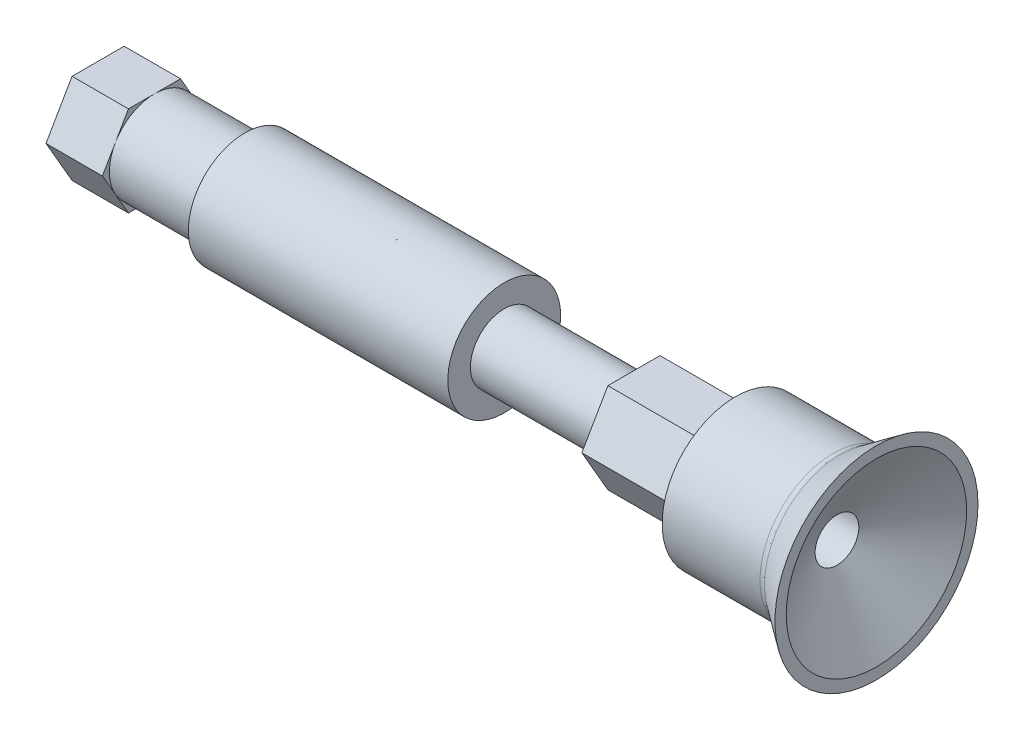
from build123d import *

# Parameters (mm, degrees)
EXTRUDE_1_DEPTH     = 5
SKETCH_2_R          = 4
EXTRUDE_2_DEPTH     = 8
SKETCH_3_R          = 5
EXTRUDE_3_DEPTH     = 23
SKETCH_4_R          = 3
EXTRUDE_4_DEPTH     = 11.5
EXTRUDE_5_DEPTH     = 9
SKETCH_6_R          = 2.5
CUT_EXTRUDE_1_DEPTH = 5
SKETCH_7_R          = 2
CUT_EXTRUDE_2_DEPTH = 8
SKETCH_8_R          = 2.5
CUT_EXTRUDE_3_DEPTH = 45.070965499
SKETCH_9_R          = 6.5
EXTRUDE_6_DEPTH     = 9
FILLET_1_R          = 1
SKETCH_11_R         = 8
CUT_EXTRUDE_4_DEPTH = 3.5
CUT_EXTRUDE_4_DRAFT = -60
CUT_EXTRUDE_START   = -10
SKETCH_12_R         = 2.5
CUT_EXTRUDE_5_DEPTH = 10


with BuildPart() as part:
    # 草图1 → 凸台-拉伸1 (new body)
    with BuildSketch(Plane(origin=(0, 0, 0), x_dir=(0, 0, -1), z_dir=(1, 0, 0))):
        Polygon((2.309401077, 4), (-2.309401077, 4), (-4.618802154, 0), (-2.309401077, -4), (2.309401077, -4), (4.618802154, 0), align=None)
    extrude(amount=EXTRUDE_1_DEPTH)

    # 草图2 → 凸台-拉伸2 (add)
    with BuildSketch(Plane(origin=(5, 0, 0), x_dir=(0, 0, -1), z_dir=(1, 0, 0))):
        with Locations(Location((0, 0, 0), (0, 0, 150))):
            Circle(SKETCH_2_R)
    extrude(amount=EXTRUDE_2_DEPTH)

    # 草图3 → 凸台-拉伸3 (add)
    with BuildSketch(Plane(origin=(13, 0, 0), x_dir=(0, 0, -1), z_dir=(1, 0, 0))):
        Circle(SKETCH_3_R)
    extrude(amount=EXTRUDE_3_DEPTH)

    # 草图4 → 凸台-拉伸4 (add)
    with BuildSketch(Plane(origin=(36, 0, 0), x_dir=(0, 0, -1), z_dir=(1, 0, 0))):
        Circle(SKETCH_4_R)
    extrude(amount=EXTRUDE_4_DEPTH)

    # 草图5 → 凸台-拉伸5 (add)
    with BuildSketch(Plane(origin=(47.5, 0, 0), x_dir=(0, 0, -1), z_dir=(1, 0, 0))):
        Polygon((2.309401077, 4), (-2.309401077, 4), (-4.618802154, 0), (-2.309401077, -4), (2.309401077, -4), (4.618802154, 0), align=None)
    extrude(amount=EXTRUDE_5_DEPTH)

    # 草图6 → 切除-拉伸1 (cut)
    with BuildSketch(Plane.ZY):
        Circle(SKETCH_6_R)
    extrude(amount=-CUT_EXTRUDE_1_DEPTH, mode=Mode.SUBTRACT)

    # 草图7 → 切除-拉伸2 (cut)
    with BuildSketch(Plane.ZY.offset(-5)):
        Circle(SKETCH_7_R)
    extrude(amount=-CUT_EXTRUDE_2_DEPTH, mode=Mode.SUBTRACT)

    # 草图8 → 切除-拉伸3 (cut, through all)
    with BuildSketch(Plane.ZY.offset(-13)):
        Circle(SKETCH_8_R)
    extrude(amount=-CUT_EXTRUDE_3_DEPTH, mode=Mode.SUBTRACT)

    # 草图9 → 凸台-拉伸6 (add)
    with BuildSketch(Plane(origin=(56.5, 0, 0), x_dir=(0, 0, -1), z_dir=(1, 0, 0))):
        Circle(SKETCH_9_R)
    extrude(amount=EXTRUDE_6_DEPTH)

    # 草图10 → 旋转1 (revolve)
    with BuildSketch(Plane(origin=(0, 0, 0), x_dir=(-1, 0, 0), z_dir=(0, 0, -1)), mode=Mode.PRIVATE) as revolve_1_sk:
        Polygon((-65.5, 0), (-69, 0), (-69, 9), (-65.5, 6.5), align=None)
    revolve(revolve_1_sk.sketch.rotate(Axis((65.5, 0, 0), (-1, 0, 0)), 90), axis=Axis((65.5, 0, 0), (-1, 0, 0)))

    # 圆角1
    fillet_1_edges = [part.edges().sort_by_distance(p)[0] for p in [
        (65.5, 0, 6.5),
    ]]
    fillet(fillet_1_edges, radius=FILLET_1_R)


with BuildPart() as cut_extrude_4_tool:
    # 草图11 → 切除-拉伸4 (with draft: the straight prism first)
    with BuildSketch(Plane(origin=(69, 0, 0), x_dir=(0, 0, -1), z_dir=(1, 0, 0))):
        Circle(SKETCH_11_R)
    extrude(amount=-CUT_EXTRUDE_4_DEPTH)
    # 切除-拉伸4: the draft: its side faces are tilted about the plane it starts from
    cut_extrude_4_sides = [cut_extrude_4_tool.faces().sort_by_distance(p)[0] for p in [
        (67.25, 0, 8),
    ]]
    draft(cut_extrude_4_sides, Plane(origin=(69, 0, 0), x_dir=(0, 0, -1), z_dir=(1, 0, 0)), CUT_EXTRUDE_4_DRAFT)


with BuildPart() as part_1:
    add(part.part)

    # 切除-拉伸4: cut by cut_extrude_4_tool
    add(cut_extrude_4_tool.part, mode=Mode.SUBTRACT)

    # 草图12 → 切除-拉伸5 (cut)
    with BuildSketch(Plane(origin=(65.5, 0, 0), x_dir=(0, 0, -1), z_dir=(1, 0, 0)).offset(CUT_EXTRUDE_START)):
        with Locations(Location((0, 0, 0), (0, 0, 180))):
            Circle(SKETCH_12_R)
    extrude(amount=CUT_EXTRUDE_5_DEPTH, mode=Mode.SUBTRACT)


solid = part_1.part
